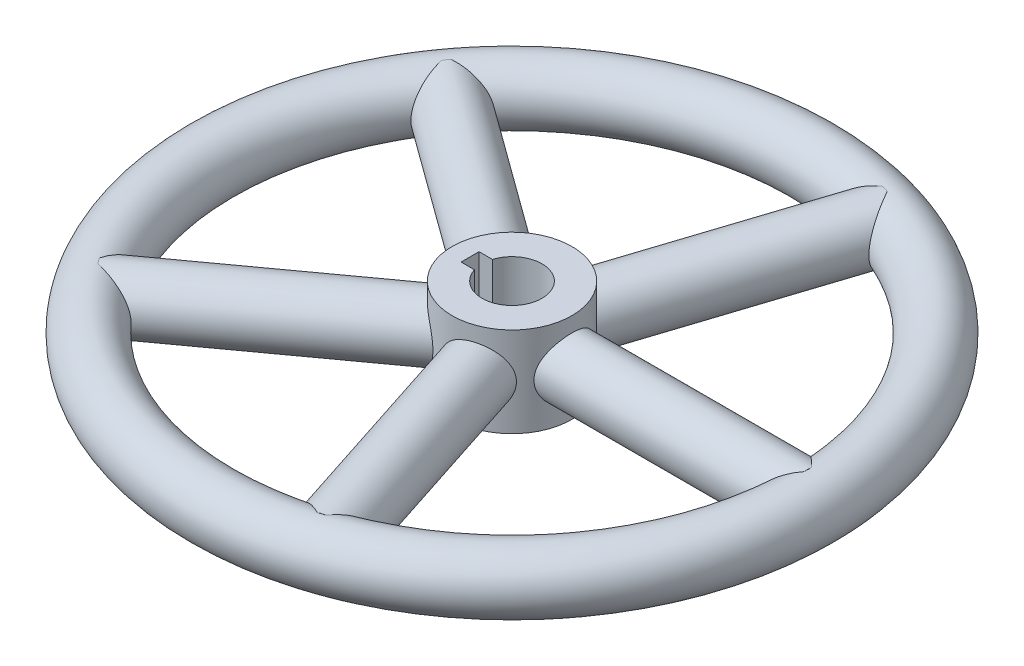
from build123d import *
from build123d.topology import SkipClean

# Parameters (mm, degrees)
SKETCH_1_R               = 5
SKETCH_1_W               = 5
SKETCH_1_H               = 15
SWEEP_4_PROFILE_R        = 5
PATTERN_CIRCULAR_1_COUNT = 5
CUT_EXTRUDE_1_DEPTH      = 80.214897747


with BuildPart() as part:
    # 草图1 → 旋转1 (revolve)
    with BuildSketch(Plane.XY, mode=Mode.PRIVATE) as revolve_1_sk:
        with Locations((50, 0)):
            Circle(SKETCH_1_R)
        with Locations((7.5, 0)):
            Rectangle(SKETCH_1_W, SKETCH_1_H)
    revolve(revolve_1_sk.sketch.rotate(Axis((0, 51.954243303, 0), (0, -1, 0)), 90), axis=Axis((0, 51.954243303, 0), (0, -1, 0)))

    # 扫描4: sweep along a path in 草图3
    with BuildLine(Plane(origin=(0, 0, 0), x_dir=(1, 0, 0), z_dir=(0, 1, 0))) as sweep_4_path:
        Line((5, 0), (49.400611146, 0))
    # 扫描4 profile (on start of the path) → 扫描4 (sweep)
    with BuildSketch(Plane(origin=(5, 0, 0), x_dir=(0, 0, 1), z_dir=(1, 0, 0))):
        Circle(SWEEP_4_PROFILE_R)
    sweep_4 = sweep(path=sweep_4_path.line)

    # 阵列(圆周)1: 扫描4 ×5 about axis
    pattern_circular_1_axis = Axis((0, 0, 0), (0, 1, 0))
    for i in range(1, PATTERN_CIRCULAR_1_COUNT):
        add(sweep_4.rotate(pattern_circular_1_axis, i * 360 / PATTERN_CIRCULAR_1_COUNT))

    # 草图2 → 切除-拉伸1 (cut, through all)
    with SkipClean():  # the faces are left unmerged after this step: merging them gives an invalid solid
        with BuildSketch(Plane(origin=(0, 7.5, 0), x_dir=(1, 0, 0), z_dir=(0, 1, 0))):
            with BuildLine():
                Line((-7, 1.5), (-4.769696007, 1.5))
                ThreePointArc((-4.769696007, 1.5), (-5, 0), (-4.769696007, -1.5))
                Line((-4.769696007, -1.5), (-7, -1.5))
                Line((-7, -1.5), (-7, 1.5))
            make_face()
        extrude(amount=-CUT_EXTRUDE_1_DEPTH, mode=Mode.SUBTRACT)


solid = part.part
